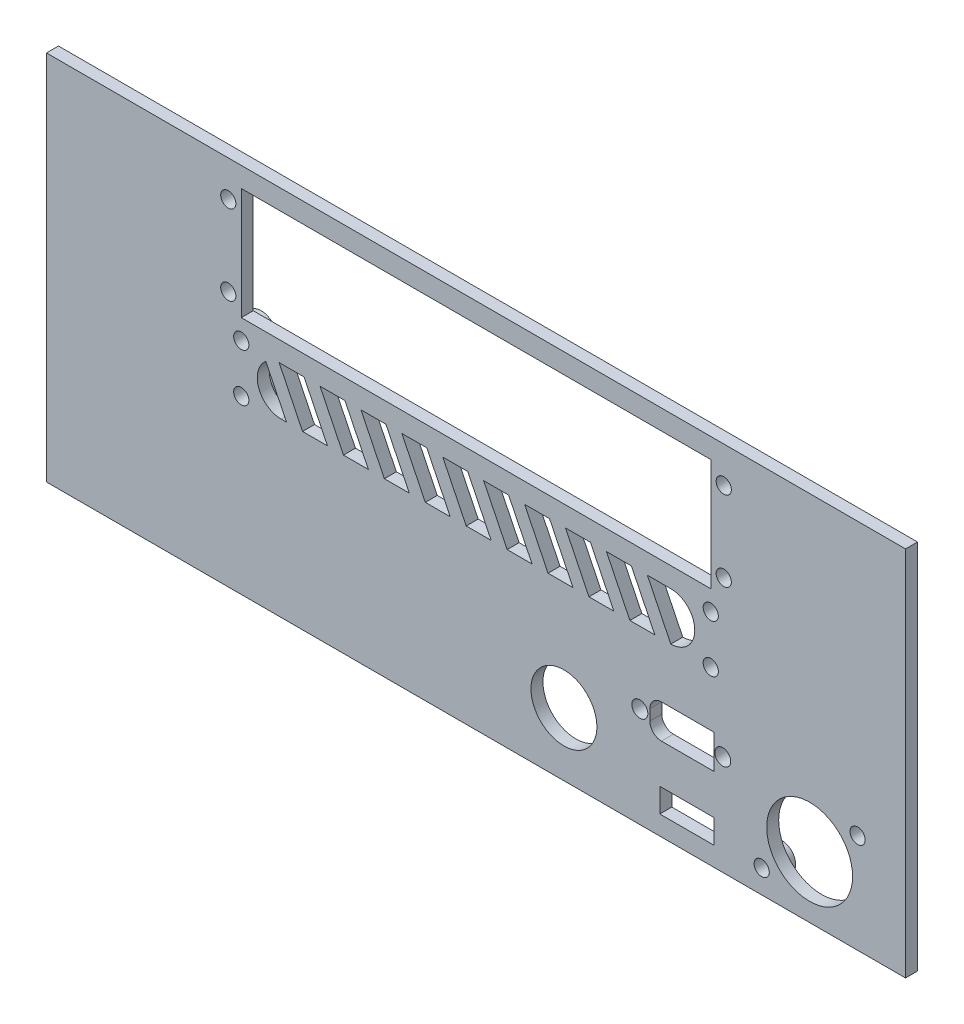
from build123d import *
from OCP.BRepFilletAPI import BRepFilletAPI_MakeChamfer

# Parameters (mm, degrees)
SZKIC1_W                    = 215
SZKIC1_H                    = 93
DODANIE_WYCI_GNI_CIE1_DEPTH = 3
DODANIE_WYCI_GNI_CIE3_DEPTH = 5
SZKIC4_R                    = 1.9
WYTNIJ_WYCI_GNI_CIE1_DEPTH  = 10
SZKIC5_R                    = 1.9
SZKIC5_W                    = 117.5
SZKIC5_H                    = 28
WYTNIJ_WYCI_GNI_CIE2_DEPTH  = 35
SFAZOWANIE1_SIZE            = 2
SFAZOWANIE1_SIZE2           = 1.42483793
SFAZOWANIE1_SIZE2_2         = 2.349845037
SZKIC6_R                    = 10.75
SZKIC6_R_2                  = 1.9
SZKIC6_R_3                  = 2
SZKIC6_W                    = 13.5
SZKIC6_H                    = 6
WYTNIJ_WYCI_GNI_CIE3_DEPTH  = 238.314137801
SZKIC8_R                    = 3.5
SZKIC8_R_2                  = 2
DODANIE_WYCI_GNI_CIE4_DEPTH = 2
SZKIC9_R                    = 1.9
WYTNIJ_WYCI_GNI_CIE4_DEPTH  = 3
DODANIE_WYCI_GNI_CIE5_START = 2
SZKIC10_R                   = 4
SZKIC10_R_2                 = 1.9
DODANIE_WYCI_GNI_CIE5_DEPTH = 2
SZKIC11_R                   = 8.25
WYTNIJ_WYCI_GNI_CIE5_DEPTH  = 10
CUT_EXTRUDE1_REACH          = 152.101


with BuildPart() as part:
    # Szkic1 → Dodanie-wyciągnięcie1 (new body)
    with BuildSketch(Plane.XY):
        with Locations((107.5, 46.5)):
            Rectangle(SZKIC1_W, SZKIC1_H)
    extrude(amount=DODANIE_WYCI_GNI_CIE1_DEPTH)

    # Szkic3 → Dodanie-wyciągnięcie3 (add, symmetric)
    with BuildSketch(Plane(origin=(107.5, 0, 0), x_dir=(0, 0, -1), z_dir=(1, 0, 0))):
        Polygon((0, 3), (10, 3), (35, 35), (35, 41), (0, 41), align=None)
        Polygon((3, 11.541451884), (3, 35), (31.193011155, 35), (9.799205499, 7.615928759), align=None, mode=Mode.SUBTRACT)
    extrude(amount=DODANIE_WYCI_GNI_CIE3_DEPTH, both=True)

    # Szkic4 → Wytnij-wyciągnięcie1 (cut)
    with BuildSketch(Plane.XZ.offset(-3)):
        with Locations(Location((107.5, -5, 0), (0, 0, 270))):
            Circle(SZKIC4_R)
    extrude(amount=-WYTNIJ_WYCI_GNI_CIE1_DEPTH, mode=Mode.SUBTRACT)

    # Szkic5 → Wytnij-wyciągnięcie2 (cut)
    with BuildSketch(Plane.XY.offset(3)):
        with Locations((45.5, 84)):
            Circle(SZKIC5_R)
        with Locations((45.5, 64)):
            Circle(SZKIC5_R)
        with Locations((169.5, 64)):
            Circle(SZKIC5_R)
        with Locations((169.5, 84)):
            Circle(SZKIC5_R)
        with Locations((107.5, 74)):
            Rectangle(SZKIC5_W, SZKIC5_H)
    extrude(amount=-WYTNIJ_WYCI_GNI_CIE2_DEPTH, mode=Mode.SUBTRACT)

    # Sfazowanie1: one chamfer whose edges measure the first distance from different faces: ONE call of the kernel's chamfer builder (chamfer() names one face for all edges)
    sfazowanie1_edges_1 = [part.edges().sort_by_distance(p)[0] for p in [
        (107.5, 35, -31.193011155),
    ]]
    sfazowanie1_side_1 = [part.faces().sort_by_distance(p)[0] for p in [
        (107.5, 35, -17.096505578),
    ]]
    sfazowanie1_edges_2 = [part.edges().sort_by_distance(p)[0] for p in [
        (107.5, 35, -3),
    ]]
    sfazowanie1_edges_3 = [part.edges().sort_by_distance(p)[0] for p in [
        (107.5, 7.615928759, -9.799205499),
    ]]
    sfazowanie1_side_3 = [part.faces().sort_by_distance(p)[0] for p in [
        (107.5, 21.30796438, -20.496108327),
    ]]
    sfazowanie1 = BRepFilletAPI_MakeChamfer(part.part.solid().wrapped)
    for e in sfazowanie1_edges_1:
        sfazowanie1.Add(SFAZOWANIE1_SIZE, SFAZOWANIE1_SIZE2, e.wrapped, sfazowanie1_side_1[0].wrapped)  # the first distance lies on this face
    for e in sfazowanie1_edges_2:
        sfazowanie1.Add(SFAZOWANIE1_SIZE, e.wrapped)
    for e in sfazowanie1_edges_3:
        sfazowanie1.Add(SFAZOWANIE1_SIZE, SFAZOWANIE1_SIZE2_2, e.wrapped, sfazowanie1_side_3[0].wrapped)  # the first distance lies on this face
    add(Compound.cast(sfazowanie1.Shape()), mode=Mode.REPLACE)

    # Szkic6 → Wytnij-wyciągnięcie3 (cut, through all)
    with BuildSketch(Plane.XY.offset(3)):
        with Locations((191, 15.35)):
            Circle(SZKIC6_R)
        with Locations((203, 24.85)):
            Circle(SZKIC6_R_2)
        with Locations((179, 5.85)):
            Circle(SZKIC6_R_2)
        with Locations((148.5, 25.05)):
            Circle(SZKIC6_R_3)
        with Locations((169.25, 25.05)):
            Circle(SZKIC6_R_3)
        with Locations((160.25, 7.8)):
            Rectangle(SZKIC6_W, SZKIC6_H)
        with BuildLine():
            Line((167, 20.8), (153.9, 20.8))
            ThreePointArc((153.9, 20.8), (151.849390335, 21.649390335), (151, 23.7))
            Line((151, 23.7), (151, 26.4))
            ThreePointArc((151, 26.4), (151.849390335, 28.450609665), (153.9, 29.3))
            Line((153.9, 29.3), (167, 29.3))
            Line((167, 29.3), (167, 20.8))
        make_face()
    extrude(amount=-WYTNIJ_WYCI_GNI_CIE3_DEPTH, mode=Mode.SUBTRACT)

    # Szkic8 → Dodanie-wyciągnięcie4 (add)
    # profile 1 of 2: a face of its own
    with BuildSketch(Plane(origin=(0, 0, 0), x_dir=(-1, 0, 0), z_dir=(0, 0, -1))):
        with Locations((-179, 5.85)):
            Circle(SZKIC8_R)
        with Locations((-179, 5.85)):
            Circle(SZKIC8_R_2, mode=Mode.SUBTRACT)
    # profile 2 of 2: a face of its own
    with BuildSketch(Plane(origin=(0, 0, 0), x_dir=(-1, 0, 0), z_dir=(0, 0, -1))):
        with Locations((-203, 24.85)):
            Circle(SZKIC8_R)
        with Locations((-203, 24.85)):
            Circle(SZKIC8_R_2, mode=Mode.SUBTRACT)
    extrude(amount=DODANIE_WYCI_GNI_CIE4_DEPTH)

    # Szkic9 → Wytnij-wyciągnięcie4 (cut)
    with BuildSketch(Plane(origin=(0, 0, 0), x_dir=(-1, 0, 0), z_dir=(0, 0, -1))):
        with BuildLine():
            Line((-150.385024789, 55), (-156.25, 55))
            ThreePointArc((-156.25, 55), (-162.25, 49), (-156.25, 43))
            Line((-156.25, 43), (-150.385024789, 55))
        make_face()
        Polygon((-140.144746897, 55), (-146.385024789, 55), (-152.25, 43), (-146.009722108, 43), align=None)
        Polygon((-129.904469005, 55), (-136.144746897, 55), (-142.009722108, 43), (-135.769444216, 43), align=None)
        Polygon((-119.664191113, 55), (-125.904469005, 55), (-131.769444216, 43), (-125.529166324, 43), align=None)
        Polygon((-109.423913221, 55), (-115.664191113, 55), (-121.529166324, 43), (-115.288888432, 43), align=None)
        Polygon((-99.183635329, 55), (-105.423913221, 55), (-111.288888432, 43), (-105.04861054, 43), align=None)
        Polygon((-88.943357437, 55), (-95.183635329, 55), (-101.04861054, 43), (-94.808332648, 43), align=None)
        Polygon((-78.703079545, 55), (-84.943357437, 55), (-90.808332648, 43), (-84.568054757, 43), align=None)
        Polygon((-68.462801653, 55), (-74.703079545, 55), (-80.568054757, 43), (-74.327776865, 43), align=None)
        with BuildLine():
            Line((-58.75, 55), (-64.462801653, 55))
            Line((-64.462801653, 55), (-70.327776865, 43))
            Line((-70.327776865, 43), (-64.087498973, 43))
            Line((-64.087498973, 43), (-58.233413005, 54.977720124))
            ThreePointArc((-58.233413005, 54.977720124), (-58.491466387, 54.994427443), (-58.75, 55))
        make_face()
        with BuildLine():
            Line((-54.904147181, 53.605368183), (-60.087498973, 43))
            Line((-60.087498973, 43), (-58.75, 43))
            ThreePointArc((-58.75, 43), (-53.109423385, 46.954542728), (-54.904147181, 53.605368183))
        make_face()
        with Locations((-166.25, 55)):
            Circle(SZKIC9_R)
        with Locations((-166.25, 43)):
            Circle(SZKIC9_R)
        with Locations((-48.75, 43)):
            Circle(SZKIC9_R)
        with Locations((-48.75, 55)):
            Circle(SZKIC9_R)
    extrude(amount=-WYTNIJ_WYCI_GNI_CIE4_DEPTH, mode=Mode.SUBTRACT)

    # Szkic10 → Dodanie-wyciągnięcie5 (add)
    # profile 1 of 4: a face of its own
    with BuildSketch(Plane(origin=(0, 0, 0), x_dir=(-1, 0, 0), z_dir=(0, 0, -1)).offset(DODANIE_WYCI_GNI_CIE5_START)):
        with Locations((-166.25, 55)):
            Circle(SZKIC10_R)
        with Locations((-166.25, 55)):
            Circle(SZKIC10_R_2, mode=Mode.SUBTRACT)
    # profile 2 of 4: a face of its own
    with BuildSketch(Plane(origin=(0, 0, 0), x_dir=(-1, 0, 0), z_dir=(0, 0, -1)).offset(DODANIE_WYCI_GNI_CIE5_START)):
        with Locations((-166.25, 43)):
            Circle(SZKIC10_R)
        with Locations((-166.25, 43)):
            Circle(SZKIC10_R_2, mode=Mode.SUBTRACT)
    # profile 3 of 4: a face of its own
    with BuildSketch(Plane(origin=(0, 0, 0), x_dir=(-1, 0, 0), z_dir=(0, 0, -1)).offset(DODANIE_WYCI_GNI_CIE5_START)):
        with Locations((-48.75, 43)):
            Circle(SZKIC10_R)
        with Locations((-48.75, 43)):
            Circle(SZKIC10_R_2, mode=Mode.SUBTRACT)
    # profile 4 of 4: a face of its own
    with BuildSketch(Plane(origin=(0, 0, 0), x_dir=(-1, 0, 0), z_dir=(0, 0, -1)).offset(DODANIE_WYCI_GNI_CIE5_START)):
        with Locations((-48.75, 55)):
            Circle(SZKIC10_R)
        with Locations((-48.75, 55)):
            Circle(SZKIC10_R_2, mode=Mode.SUBTRACT)
    extrude(amount=-DODANIE_WYCI_GNI_CIE5_DEPTH)

    # Szkic11 → Wytnij-wyciągnięcie5 (cut)
    with BuildSketch(Plane(origin=(0, 0, 0), x_dir=(-1, 0, 0), z_dir=(0, 0, -1))):
        with Locations((-129.5, 15.8)):
            Circle(SZKIC11_R)
    extrude(amount=-WYTNIJ_WYCI_GNI_CIE5_DEPTH, mode=Mode.SUBTRACT)

    # Sketch1 → Cut-Extrude1 (cut, up to next)
    with BuildSketch(Plane(origin=(112.5, 0, 0), x_dir=(0, 0, -1), z_dir=(1, 0, 0)), mode=Mode.PRIVATE) as cut_extrude1_sk1:
        Polygon((0, 41), (0, 3), (10, 3), (35, 35), (35, 41), align=None)
    cut_extrude1_tool1 = extrude(cut_extrude1_sk1.sketch, amount=-CUT_EXTRUDE1_REACH, mode=Mode.PRIVATE) & part.part
    add(cut_extrude1_tool1.solids().sort_by_distance((112.5, 25.584229, -13.557348))[0], mode=Mode.SUBTRACT)


solid = part.part
